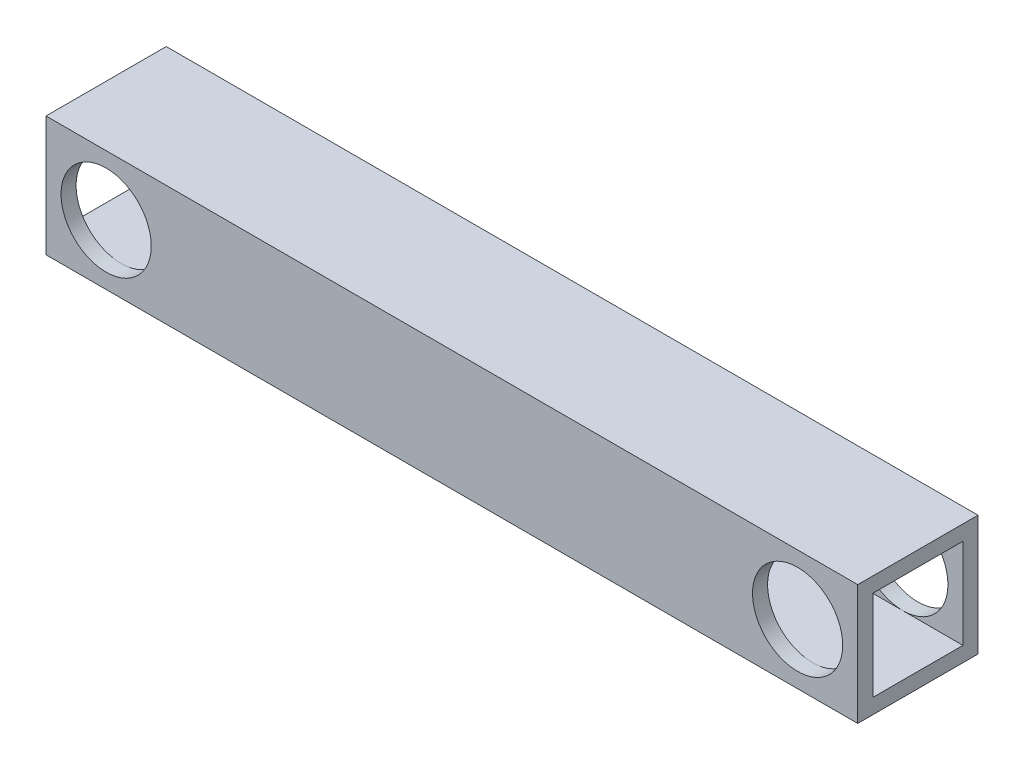
from build123d import *

# Parameters (mm, degrees)
SKETCH1_W           = 171.45
SKETCH1_H           = 25.4
SKETCH1_R           = 9.525
BOSS_EXTRUDE1_DEPTH = 25.4
SKETCH2_W           = 19.05
SKETCH2_H           = 19.05
CUT_EXTRUDE1_DEPTH  = 174.785938729


with BuildPart() as part:
    # Sketch1 → Boss-Extrude1 (new body)
    with BuildSketch(Plane.XY):
        with Locations((73.025, 0)):
            Rectangle(SKETCH1_W, SKETCH1_H)
        Circle(SKETCH1_R, mode=Mode.SUBTRACT)
        with Locations((146.05, 0)):
            Circle(SKETCH1_R, mode=Mode.SUBTRACT)
    extrude(amount=BOSS_EXTRUDE1_DEPTH)

    # Sketch2 → Cut-Extrude1 (cut, through all)
    with BuildSketch(Plane(origin=(158.75, 0, 0), x_dir=(0, 0, -1), z_dir=(1, 0, 0))):
        with Locations((-12.7, 0)):
            Rectangle(SKETCH2_W, SKETCH2_H)
    extrude(amount=-CUT_EXTRUDE1_DEPTH, mode=Mode.SUBTRACT)


solid = part.part
